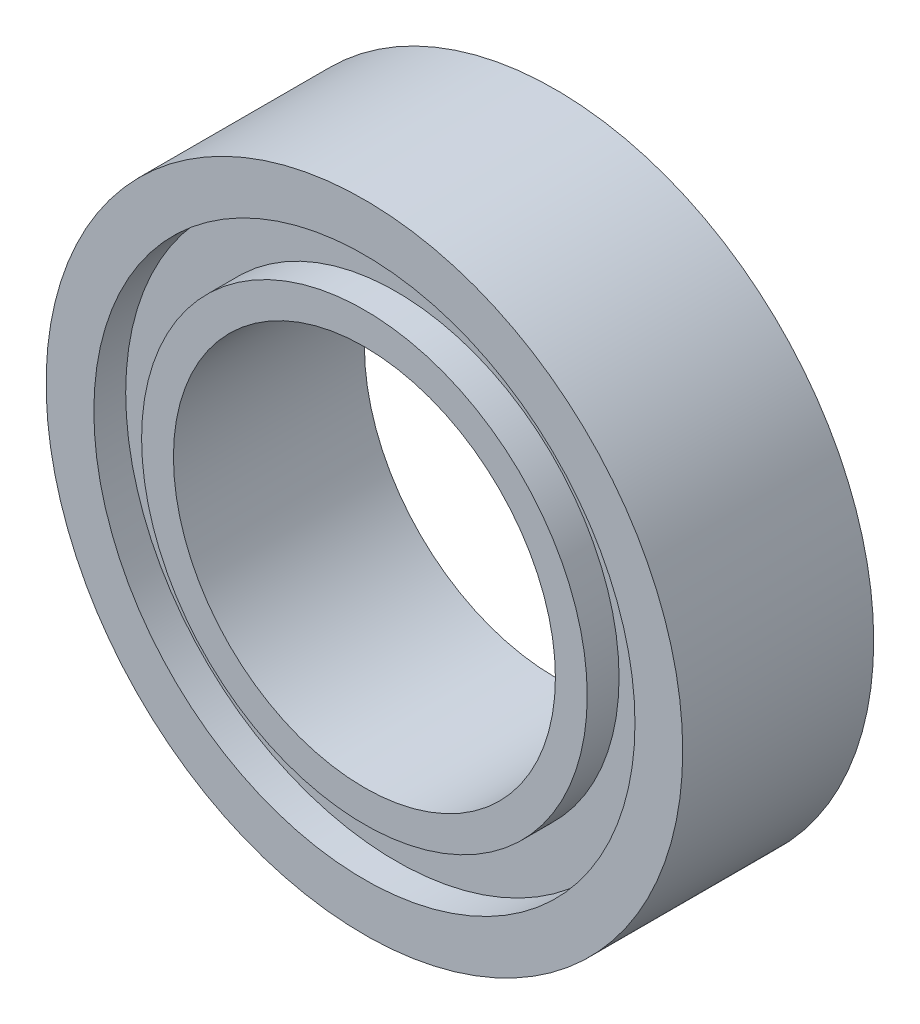
from build123d import *

# Parameters (mm, degrees)
SKETCH_1_R          = 5
SKETCH_1_R_2        = 3
EXTRUDE_1_DEPTH     = 3
SKETCH_2_R          = 4.25
SKETCH_2_R_2        = 3.5
CUT_EXTRUDE_1_DEPTH = 0.5


with BuildPart() as part:
    # 草图1 → 凸台-拉伸1 (new body)
    with BuildSketch(Plane.XY):
        Circle(SKETCH_1_R)
        Circle(SKETCH_1_R_2, mode=Mode.SUBTRACT)
    extrude(amount=EXTRUDE_1_DEPTH)

    # 草图2 → 切除-拉伸1 (cut)
    with BuildSketch(Plane.XY.offset(3)):
        Circle(SKETCH_2_R)
        Circle(SKETCH_2_R_2, mode=Mode.SUBTRACT)
    cut_extrude_1 = extrude(amount=-CUT_EXTRUDE_1_DEPTH, mode=Mode.SUBTRACT)

    # 镜向1: 切除-拉伸1 across plane
    add(cut_extrude_1.mirror(Plane.XY.offset(1.5)), mode=Mode.SUBTRACT)


solid = part.part
